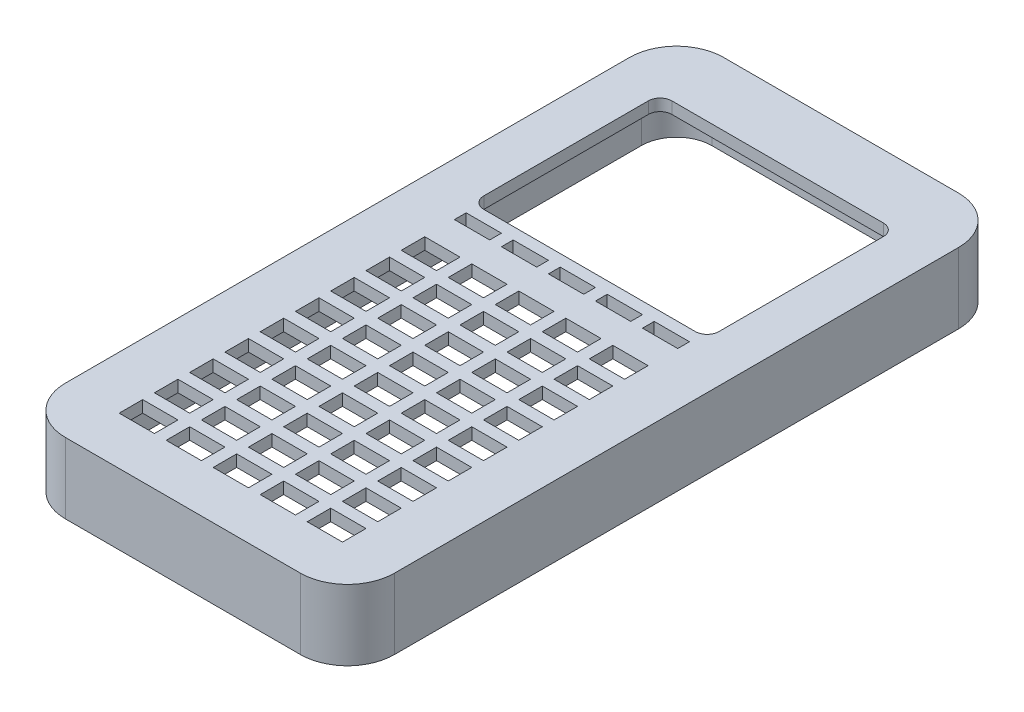
from build123d import *

# Parameters (mm, degrees)
BOSS_EXTRUDE1_DEPTH = 19.05
SHELL1_T            = -3.175
SKETCH2_W           = 9.525
SKETCH2_H           = 3.175
SKETCH2_H_2         = 6.35
CUT_EXTRUDE1_DEPTH  = 19.05


with BuildPart() as part:
    # Sketch1 → Boss-Extrude1 (new body)
    with BuildSketch(Plane(origin=(0, 0, 0), x_dir=(1, 0, 0), z_dir=(0, 1, 0))):
        with BuildLine():
            Line((31.75, 0), (-31.75, 0))
            ThreePointArc((-31.75, 0), (-40.730256121, -3.719743879), (-44.45, -12.7))
            Line((-44.45, -12.7), (-44.45, -165.1))
            ThreePointArc((-44.45, -165.1), (-40.730256121, -174.080256121), (-31.75, -177.8))
            Line((-31.75, -177.8), (31.75, -177.8))
            ThreePointArc((31.75, -177.8), (40.730256121, -174.080256121), (44.45, -165.1))
            Line((44.45, -165.1), (44.45, -12.7))
            ThreePointArc((44.45, -12.7), (40.730256121, -3.719743879), (31.75, 0))
        make_face()
    extrude(amount=BOSS_EXTRUDE1_DEPTH)

    # Shell1
    shell1_openings = [part.faces().sort_by_distance(p)[0] for p in [
        (0, 0, 88.9),
    ]]
    offset(amount=SHELL1_T, openings=shell1_openings, kind=Kind.INTERSECTION)

    # Sketch2 → Cut-Extrude1 (cut)
    with BuildSketch(Plane(origin=(0, 19.05, 0), x_dir=(1, 0, 0), z_dir=(0, 1, 0))):
        with BuildLine():
            Line((28.575, -17.145), (-28.575, -17.145))
            ThreePointArc((-28.575, -17.145), (-30.82006403, -18.07493597), (-31.75, -20.32))
            Line((-31.75, -20.32), (-31.75, -64.77))
            ThreePointArc((-31.75, -64.77), (-30.82006403, -67.01506403), (-28.575, -67.945))
            Line((-28.575, -67.945), (28.575, -67.945))
            ThreePointArc((28.575, -67.945), (30.82006403, -67.01506403), (31.75, -64.77))
            Line((31.75, -64.77), (31.75, -20.32))
            ThreePointArc((31.75, -20.32), (30.82006403, -18.07493597), (28.575, -17.145))
        make_face()
        with Locations((-25.4, -72.7075)):
            Rectangle(SKETCH2_W, SKETCH2_H)
        with Locations((-25.4, -161.680125741)):
            Rectangle(SKETCH2_W, SKETCH2_H_2)
        with Locations((-12.7, -161.680125741)):
            Rectangle(SKETCH2_W, SKETCH2_H_2)
        with Locations((0, -161.680125741)):
            Rectangle(SKETCH2_W, SKETCH2_H_2)
        with Locations((12.7, -161.680125741)):
            Rectangle(SKETCH2_W, SKETCH2_H_2)
        with Locations((25.4, -161.680125741)):
            Rectangle(SKETCH2_W, SKETCH2_H_2)
        with Locations((-12.7, -152.155125741)):
            Rectangle(SKETCH2_W, SKETCH2_H_2)
        with Locations((0, -152.155125741)):
            Rectangle(SKETCH2_W, SKETCH2_H_2)
        with Locations((12.7, -152.155125741)):
            Rectangle(SKETCH2_W, SKETCH2_H_2)
        with Locations((25.4, -152.155125741)):
            Rectangle(SKETCH2_W, SKETCH2_H_2)
        with Locations((-12.7, -142.630125741)):
            Rectangle(SKETCH2_W, SKETCH2_H_2)
        with Locations((0, -142.630125741)):
            Rectangle(SKETCH2_W, SKETCH2_H_2)
        with Locations((12.7, -142.630125741)):
            Rectangle(SKETCH2_W, SKETCH2_H_2)
        with Locations((25.4, -142.630125741)):
            Rectangle(SKETCH2_W, SKETCH2_H_2)
        with Locations((-12.7, -133.105125741)):
            Rectangle(SKETCH2_W, SKETCH2_H_2)
        with Locations((0, -133.105125741)):
            Rectangle(SKETCH2_W, SKETCH2_H_2)
        with Locations((12.7, -133.105125741)):
            Rectangle(SKETCH2_W, SKETCH2_H_2)
        with Locations((25.4, -133.105125741)):
            Rectangle(SKETCH2_W, SKETCH2_H_2)
        with Locations((-12.7, -123.580125741)):
            Rectangle(SKETCH2_W, SKETCH2_H_2)
        with Locations((0, -123.580125741)):
            Rectangle(SKETCH2_W, SKETCH2_H_2)
        with Locations((12.7, -123.580125741)):
            Rectangle(SKETCH2_W, SKETCH2_H_2)
        with Locations((25.4, -123.580125741)):
            Rectangle(SKETCH2_W, SKETCH2_H_2)
        with Locations((-12.7, -114.055125741)):
            Rectangle(SKETCH2_W, SKETCH2_H_2)
        with Locations((0, -114.055125741)):
            Rectangle(SKETCH2_W, SKETCH2_H_2)
        with Locations((12.7, -114.055125741)):
            Rectangle(SKETCH2_W, SKETCH2_H_2)
        with Locations((25.4, -114.055125741)):
            Rectangle(SKETCH2_W, SKETCH2_H_2)
        with Locations((-12.7, -104.530125741)):
            Rectangle(SKETCH2_W, SKETCH2_H_2)
        with Locations((0, -104.530125741)):
            Rectangle(SKETCH2_W, SKETCH2_H_2)
        with Locations((12.7, -104.530125741)):
            Rectangle(SKETCH2_W, SKETCH2_H_2)
        with Locations((25.4, -104.530125741)):
            Rectangle(SKETCH2_W, SKETCH2_H_2)
        with Locations((-12.7, -95.005125741)):
            Rectangle(SKETCH2_W, SKETCH2_H_2)
        with Locations((0, -95.005125741)):
            Rectangle(SKETCH2_W, SKETCH2_H_2)
        with Locations((12.7, -95.005125741)):
            Rectangle(SKETCH2_W, SKETCH2_H_2)
        with Locations((25.4, -95.005125741)):
            Rectangle(SKETCH2_W, SKETCH2_H_2)
        with Locations((-12.7, -85.480125741)):
            Rectangle(SKETCH2_W, SKETCH2_H_2)
        with Locations((0, -85.480125741)):
            Rectangle(SKETCH2_W, SKETCH2_H_2)
        with Locations((12.7, -85.480125741)):
            Rectangle(SKETCH2_W, SKETCH2_H_2)
        with Locations((25.4, -85.480125741)):
            Rectangle(SKETCH2_W, SKETCH2_H_2)
        with Locations((-25.4, -152.155125741)):
            Rectangle(SKETCH2_W, SKETCH2_H_2)
        with Locations((-25.4, -142.630125741)):
            Rectangle(SKETCH2_W, SKETCH2_H_2)
        with Locations((-25.4, -133.105125741)):
            Rectangle(SKETCH2_W, SKETCH2_H_2)
        with Locations((-25.4, -123.580125741)):
            Rectangle(SKETCH2_W, SKETCH2_H_2)
        with Locations((-25.4, -114.055125741)):
            Rectangle(SKETCH2_W, SKETCH2_H_2)
        with Locations((-25.4, -104.530125741)):
            Rectangle(SKETCH2_W, SKETCH2_H_2)
        with Locations((-25.4, -95.005125741)):
            Rectangle(SKETCH2_W, SKETCH2_H_2)
        with Locations((-25.4, -85.480125741)):
            Rectangle(SKETCH2_W, SKETCH2_H_2)
        with Locations((-12.7, -72.7075)):
            Rectangle(SKETCH2_W, SKETCH2_H)
        with Locations((0, -72.7075)):
            Rectangle(SKETCH2_W, SKETCH2_H)
        with Locations((12.7, -72.7075)):
            Rectangle(SKETCH2_W, SKETCH2_H)
        with Locations((25.4, -72.7075)):
            Rectangle(SKETCH2_W, SKETCH2_H)
    extrude(amount=-CUT_EXTRUDE1_DEPTH, mode=Mode.SUBTRACT)


solid = part.part
